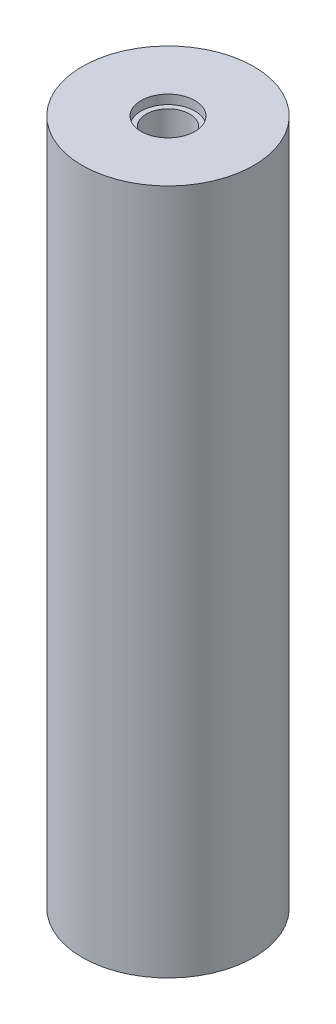
from build123d import *

# Parameters (mm, degrees)
SKETCH1_R           = 7.5
BOSS_EXTRUDE1_DEPTH = 60
SKETCH2_R           = 1.9
CUT_EXTRUDE1_DEPTH  = 5.2
CUT_EXTRUDE2_START  = -5.2
SKETCH3_R           = 1.9
CUT_EXTRUDE2_DEPTH  = 5.2
SKETCH4_R           = 2.35
CUT_EXTRUDE3_DEPTH  = 0.8
CUT_EXTRUDE4_START  = -0.8
SKETCH5_R           = 2.35
CUT_EXTRUDE4_DEPTH  = 0.8


with BuildPart() as part:
    # Sketch1 → Boss-Extrude1 (new body)
    with BuildSketch(Plane(origin=(0, 0, 0), x_dir=(1, 0, 0), z_dir=(0, 1, 0))):
        with Locations(Location((0, 0, 0), (0, 0, 270))):
            Circle(SKETCH1_R)
    extrude(amount=BOSS_EXTRUDE1_DEPTH)

    # Sketch2 → Cut-Extrude1 (cut)
    with BuildSketch(Plane(origin=(0, 60, 0), x_dir=(1, 0, 0), z_dir=(0, 1, 0))):
        with Locations(Location((0, 0, 0), (0, 0, 270))):
            Circle(SKETCH2_R)
    extrude(amount=-CUT_EXTRUDE1_DEPTH, mode=Mode.SUBTRACT)

    # Sketch3 → Cut-Extrude2 (cut)
    with BuildSketch(Plane.XZ.offset(CUT_EXTRUDE2_START)):
        with Locations(Location((0, 0, 0), (0, 0, 90))):
            Circle(SKETCH3_R)
    extrude(amount=CUT_EXTRUDE2_DEPTH, mode=Mode.SUBTRACT)

    # Sketch4 → Cut-Extrude3 (cut)
    with BuildSketch(Plane(origin=(0, 60, 0), x_dir=(1, 0, 0), z_dir=(0, 1, 0))):
        with Locations(Location((0, 0, 0), (0, 0, 270))):
            Circle(SKETCH4_R)
    extrude(amount=-CUT_EXTRUDE3_DEPTH, mode=Mode.SUBTRACT)

    # Sketch5 → Cut-Extrude4 (cut)
    with BuildSketch(Plane.XZ.offset(CUT_EXTRUDE4_START)):
        with Locations(Location((0, 0, 0), (0, 0, 90))):
            Circle(SKETCH5_R)
    extrude(amount=CUT_EXTRUDE4_DEPTH, mode=Mode.SUBTRACT)


solid = part.part
